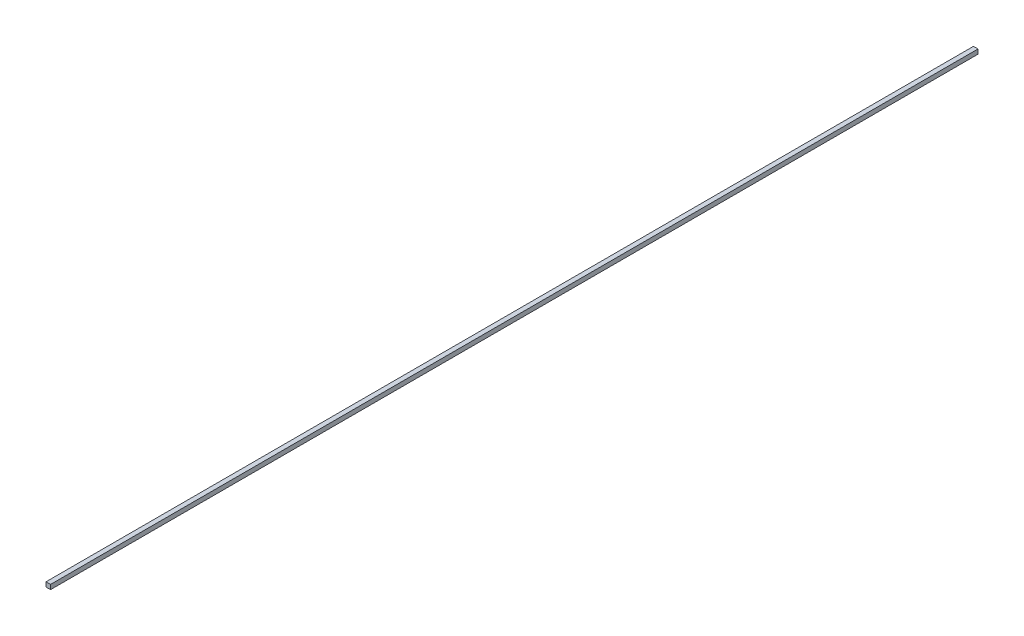
from build123d import *

# Parameters (mm, degrees)
SKETCH1_W           = 9
SKETCH1_H           = 9
BOSS_EXTRUDE1_DEPTH = 916.874


with BuildPart() as part:
    # Sketch1 → Boss-Extrude1 (new body)
    with BuildSketch(Plane.XY):
        Rectangle(SKETCH1_W, SKETCH1_H)
    extrude(amount=BOSS_EXTRUDE1_DEPTH)

    # Mirror1: part across plane


with BuildPart() as part_1:
    add(part.part)
    add(part.part.mirror(Plane.XY))


solid = part_1.part
